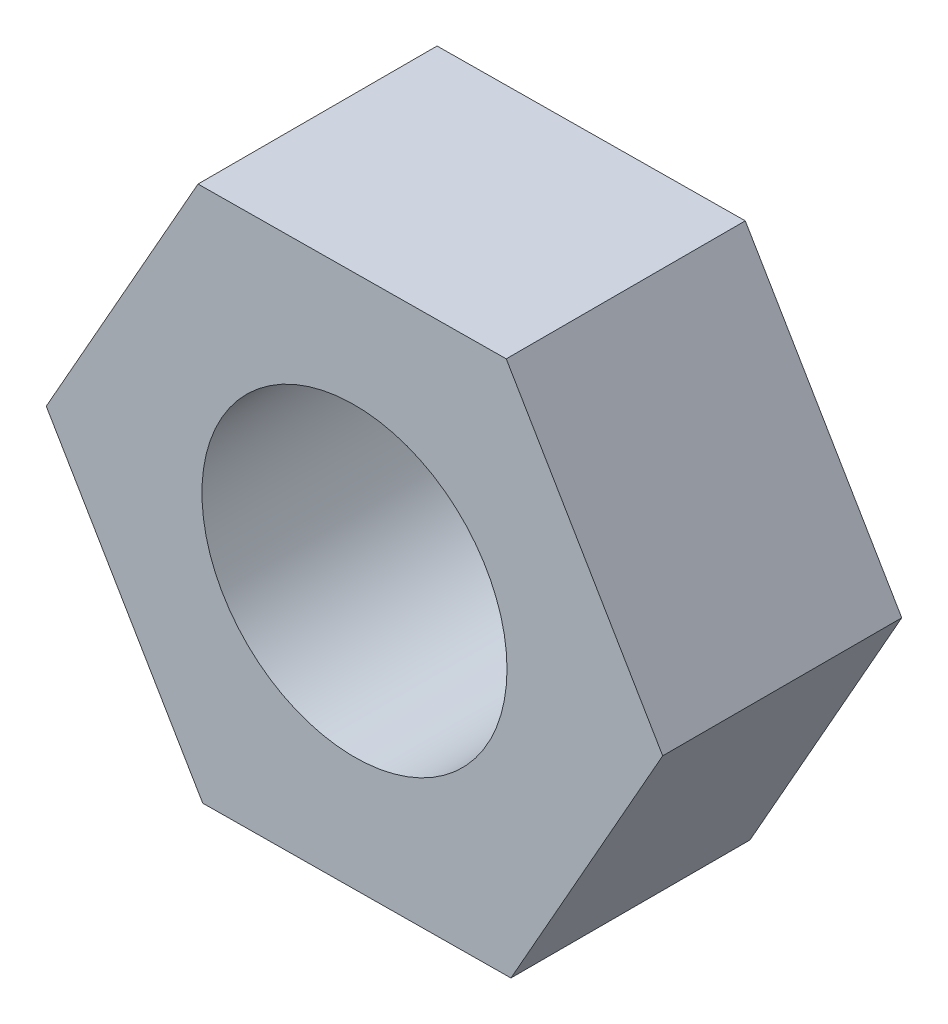
from build123d import *

# Parameters (mm, degrees)
SKETCH_1_R      = 1.914285714
EXTRUDE_1_DEPTH = 3


with BuildPart() as part:
    # 草图1 → 凸台-拉伸1 (new body)
    with BuildSketch(Plane.XY):
        Polygon((1.963536694, -3.332845178), (3.868096939, 0.034050069), (1.904560244, 3.366895248), (-1.963536694, 3.332845178), (-3.868096939, -0.034050069), (-1.904560244, -3.366895248), align=None)
        Circle(SKETCH_1_R, mode=Mode.SUBTRACT)
    extrude(amount=EXTRUDE_1_DEPTH)


solid = part.part
